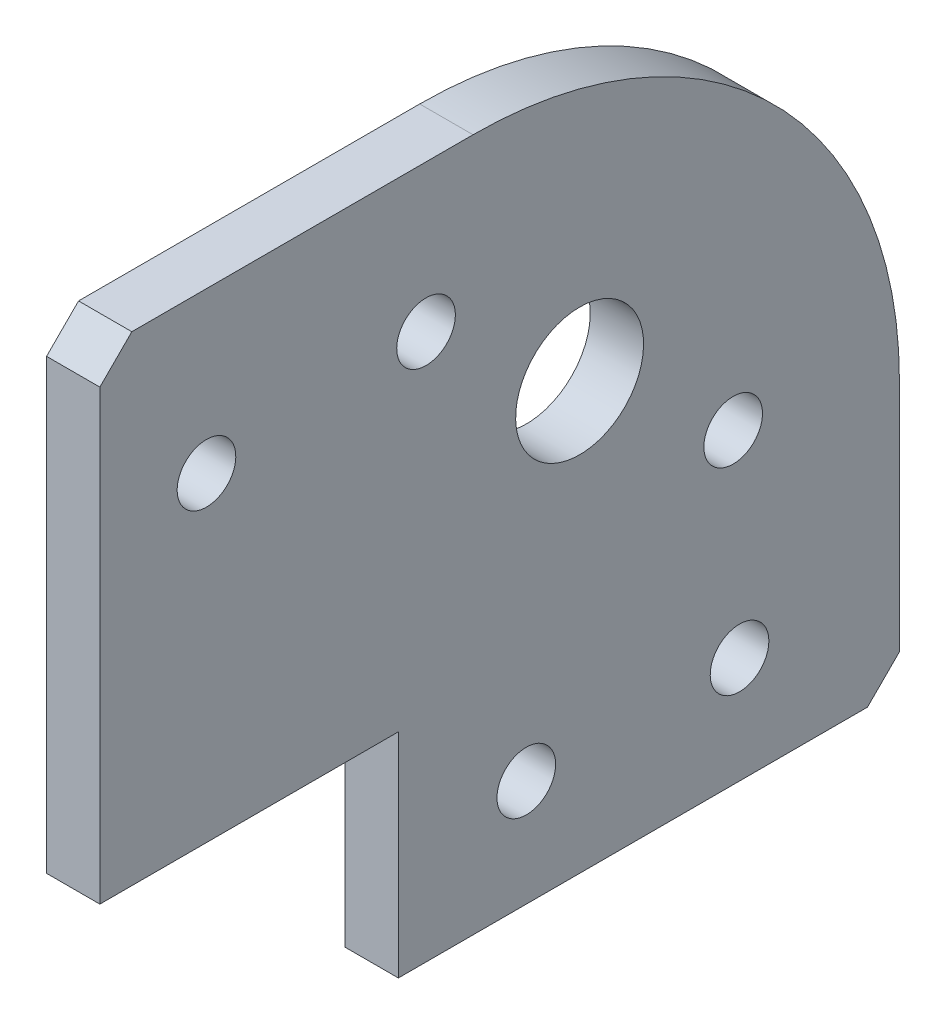
from build123d import *

# Parameters (mm, degrees)
SKETCH1_W           = 65
SKETCH1_H           = 75
SKETCH1_R           = 2.75
SKETCH1_R_2         = 6
BOSS_EXTRUDE1_DEPTH = 5
CHAMFER1_SIZE       = 3
CUT_EXTRUDE1_REACH  = 58.789
SKETCH2_R           = 2.75
CUT_EXTRUDE2_REACH  = 58.789
SKETCH3_W           = 28
SKETCH3_H           = 20
FILLET1_R           = 40


with BuildPart() as part:
    # Sketch1 → Boss-Extrude1 (new body)
    with BuildSketch(Plane(origin=(600.828774839, 0, 0), x_dir=(0, -1, 0), z_dir=(-1, 0, 0))):
        with Locations((7.5, -2.5)):
            Rectangle(SKETCH1_W, SKETCH1_H)
        with Locations((30, -5)):
            Circle(SKETCH1_R, mode=Mode.SUBTRACT)
        with Locations(Location((-10, 25, 0), (0, 0, 180))):
            Circle(SKETCH1_R, mode=Mode.SUBTRACT)
        with Locations(Location((30, -25, 0), (0, 0, 180))):
            Circle(SKETCH1_R, mode=Mode.SUBTRACT)
        with Locations(Location((0, -10, 0), (0, 0, 180))):
            Circle(SKETCH1_R_2, mode=Mode.SUBTRACT)
    extrude(amount=-BOSS_EXTRUDE1_DEPTH)

    # Chamfer1
    chamfer1_edges = [part.edges().sort_by_distance(p)[0] for p in [
        (603.328774839, 25, 35),
        (603.328774839, -40, 35),
        (603.328774839, -40, -40),
    ]]
    chamfer(chamfer1_edges, length=CHAMFER1_SIZE)

    # Sketch2 → Cut-Extrude1 (cut, up to next)
    with BuildSketch(Plane.ZY.offset(-600.828774839), mode=Mode.PRIVATE) as cut_extrude1_sk1:
        with Locations(Location((4.405677967, 11.204416197, 0), (0, 0, 270))):
            Circle(SKETCH2_R)
    cut_extrude1_tool1 = extrude(cut_extrude1_sk1.sketch, amount=-CUT_EXTRUDE1_REACH, mode=Mode.PRIVATE) & part.part
    # Sketch2 → Cut-Extrude1 (cut, up to next)
    with BuildSketch(Plane.ZY.offset(-600.828774839), mode=Mode.PRIVATE) as cut_extrude1_sk2:
        with Locations(Location((-24.405677967, -11.204416197, 0), (0, 0, 270))):
            Circle(SKETCH2_R)
    cut_extrude1_tool2 = extrude(cut_extrude1_sk2.sketch, amount=-CUT_EXTRUDE1_REACH, mode=Mode.PRIVATE) & part.part
    add(cut_extrude1_tool1.solids().sort_by_distance((600.828775, 11.204416, 4.405678))[0], mode=Mode.SUBTRACT)
    add(cut_extrude1_tool2.solids().sort_by_distance((600.828775, -11.204416, -24.405678))[0], mode=Mode.SUBTRACT)

    # Sketch3 → Cut-Extrude2 (cut, up to next)
    with BuildSketch(Plane.ZY.offset(-600.828774839), mode=Mode.PRIVATE) as cut_extrude2_sk1:
        with Locations((21, -30)):
            Rectangle(SKETCH3_W, SKETCH3_H)
    cut_extrude2_tool1 = extrude(cut_extrude2_sk1.sketch, amount=-CUT_EXTRUDE2_REACH, mode=Mode.PRIVATE) & part.part
    add(cut_extrude2_tool1.solids().sort_by_distance((600.828775, -30, 21))[0], mode=Mode.SUBTRACT)

    # Fillet1
    fillet1_edges = [part.edges().sort_by_distance(p)[0] for p in [
        (603.328774839, 25, -40),
    ]]
    fillet(fillet1_edges, radius=FILLET1_R)


solid = part.part
